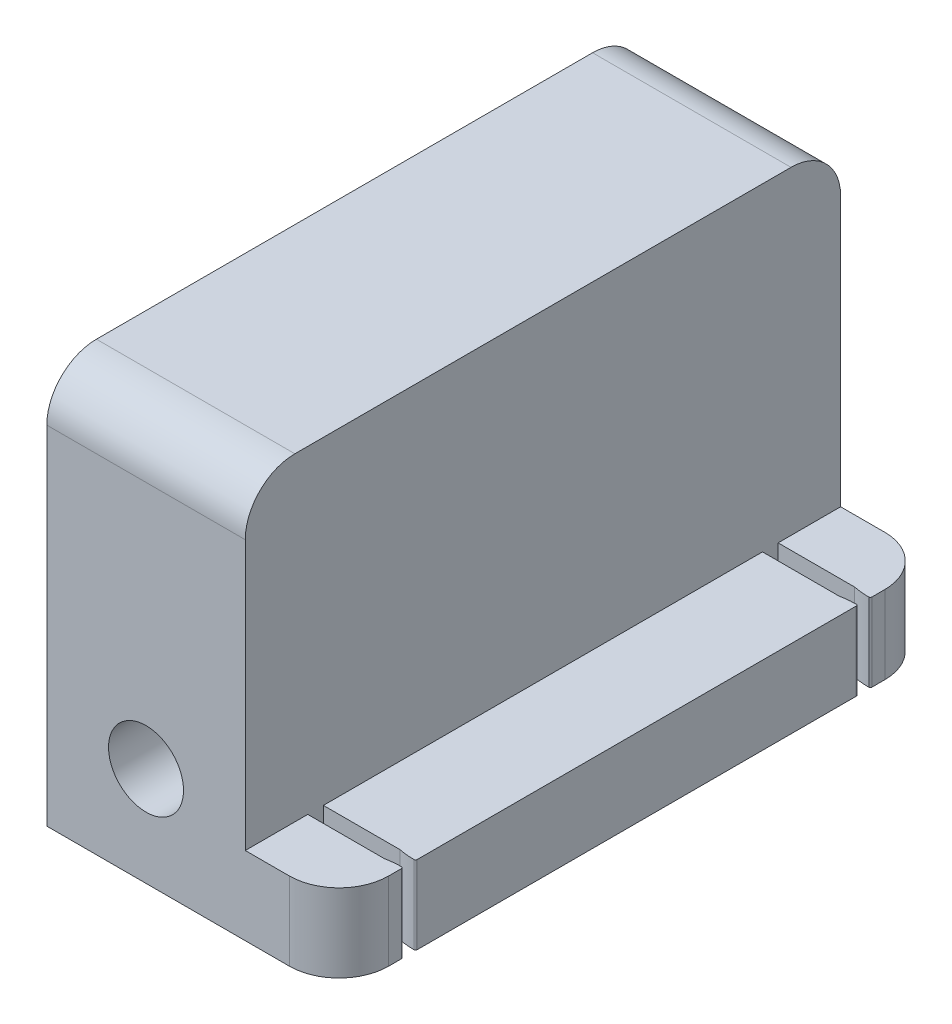
from build123d import *

# Parameters (mm, degrees)
SKETCH1_W           = 25.4
SKETCH1_H           = 50.8
SKETCH1_R           = 4.8006
BOSS_EXTRUDE1_DEPTH = 38.1
SKETCH2_R           = 4.8006
CUT_EXTRUDE1_DEPTH  = 48.519048812
SKETCH3_W           = 12
SKETCH3_H           = 76.2
BOSS_EXTRUDE2_DEPTH = 10
CUT_EXTRUDE2_DEPTH  = 53.027492732
FILLET1_R           = 6.35


with BuildPart() as part:
    # Sketch1 → Boss-Extrude1 (new, symmetric)
    with BuildSketch(Plane.XY):
        Rectangle(SKETCH1_W, SKETCH1_H)
        with Locations(Location((0, -12.7, 0), (0, 0, 180))):
            Circle(SKETCH1_R, mode=Mode.SUBTRACT)
    extrude(amount=BOSS_EXTRUDE1_DEPTH, both=True)

    # Sketch2 → Cut-Extrude1 (cut, through all)
    with BuildSketch(Plane(origin=(0, 0, 0), x_dir=(0, 0, -1), z_dir=(1, 0, 0))):
        with Locations((-25.4, 12.7)):
            Circle(SKETCH2_R)
        with Locations(Location((25.4, 12.7, 0), (0, 0, 180))):
            Circle(SKETCH2_R)
    extrude(amount=-CUT_EXTRUDE1_DEPTH, mode=Mode.SUBTRACT)

    # Sketch3 → Boss-Extrude2 (add)
    with BuildSketch(Plane.XZ.offset(25.4)):
        with Locations((18.7, 0)):
            Rectangle(SKETCH3_W, SKETCH3_H)
    extrude(amount=-BOSS_EXTRUDE2_DEPTH)

    # Sketch4 → Cut-Extrude2 (cut, through all)
    with BuildSketch(Plane(origin=(0, 0, 0), x_dir=(1, 0, 0), z_dir=(0, 1, 0))):
        with BuildLine():
            Line((24.7, 30.1), (24.7, 28.1))
            ThreePointArc((24.7, 28.1), (24.641421356, 28.241421356), (24.5, 28.3))
            ThreePointArc((24.5, 28.3), (23.495012438, 28.249875621), (22.5, 28.1))
            Line((22.5, 28.1), (12.7, 28.1))
            Line((12.7, 28.1), (12.7, 30.1))
            Line((12.7, 30.1), (22.5, 30.1))
            ThreePointArc((22.5, 30.1), (23.495012438, 29.950124379), (24.5, 29.9))
            ThreePointArc((24.5, 29.9), (24.641421356, 29.958578644), (24.7, 30.1))
        make_face()
        with BuildLine():
            Line((24.7, -30.1), (24.7, -28.1))
            ThreePointArc((24.7, -28.1), (24.641421356, -28.241421356), (24.5, -28.3))
            ThreePointArc((24.5, -28.3), (23.495012438, -28.249875621), (22.5, -28.1))
            Line((22.5, -28.1), (12.7, -28.1))
            Line((12.7, -28.1), (12.7, -30.1))
            Line((12.7, -30.1), (22.5, -30.1))
            ThreePointArc((22.5, -30.1), (23.495012438, -29.950124379), (24.5, -29.9))
            ThreePointArc((24.5, -29.9), (24.641421356, -29.958578644), (24.7, -30.1))
        make_face()
    extrude(amount=-CUT_EXTRUDE2_DEPTH, mode=Mode.SUBTRACT)

    # Fillet1
    fillet1_edges = [part.edges().sort_by_distance(p)[0] for p in [
        (24.7, -20.4, 38.1),
        (24.7, -20.4, -38.1),
        (0, 25.4, -38.1),
        (0, 25.4, 38.1),
    ]]
    fillet(fillet1_edges, radius=FILLET1_R)


solid = part.part
